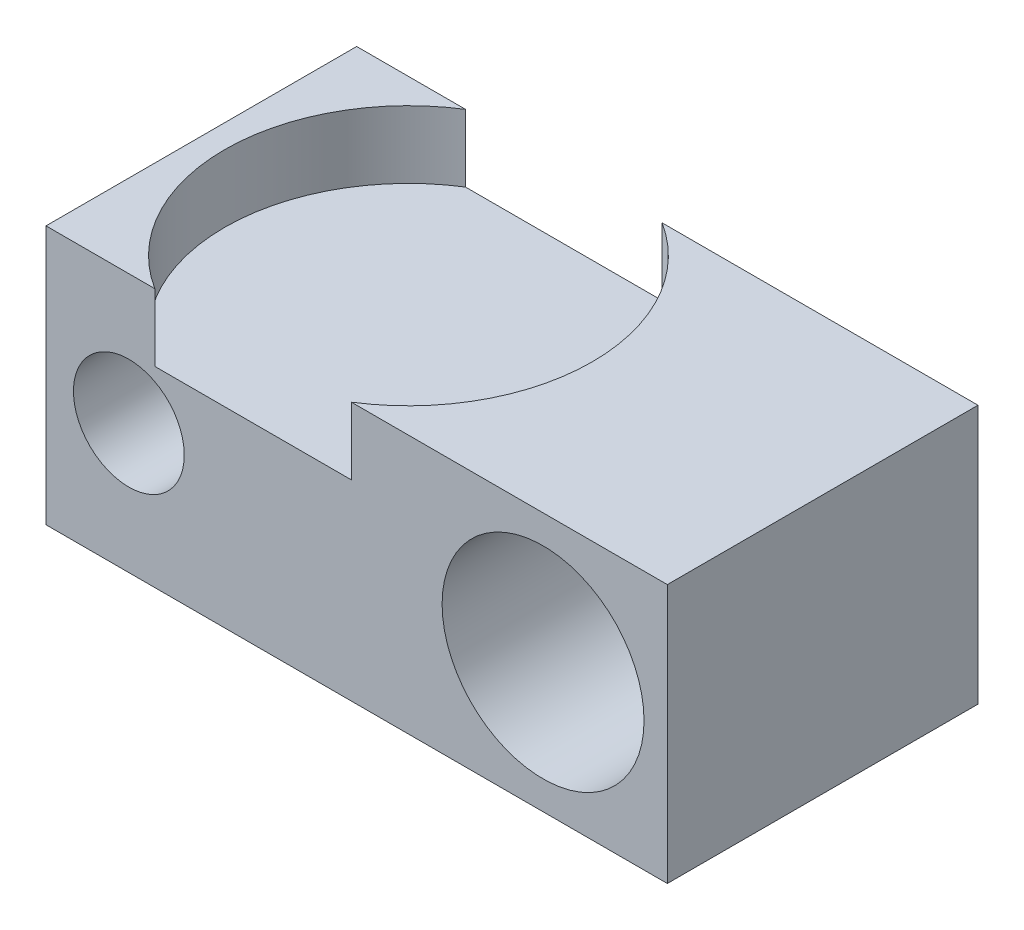
from build123d import *
from build123d.topology import SkipClean

# Parameters (mm, degrees)
SKETCH1_W           = 60
SKETCH1_H           = 25
SKETCH1_R           = 9.75
SKETCH1_R_2         = 5.35
BOSS_EXTRUDE1_DEPTH = 30
BOSS_EXTRUDE2_DEPTH = 0.0001
CUT_EXTRUDE1_START  = -6.5
SKETCH2_3_R         = 17.75
CUT_EXTRUDE1_DEPTH  = 6.5


with BuildPart() as part:
    # Sketch1 → Boss-Extrude1 (new body)
    with BuildSketch(Plane.XY):
        Rectangle(SKETCH1_W, SKETCH1_H)
        with Locations((18, 0)):
            Circle(SKETCH1_R, mode=Mode.SUBTRACT)
        with Locations((-22, 0)):
            Circle(SKETCH1_R_2, mode=Mode.SUBTRACT)
    extrude(amount=BOSS_EXTRUDE1_DEPTH)

    # Sketch2 → Boss-Extrude2 (add)
    with BuildSketch(Plane(origin=(0, 12.5, 0), x_dir=(1, 0, 0), z_dir=(0, 1, 0))):
        with BuildLine():
            ThreePointArc((-0.509873552, 0), (7.75, -15), (-0.509873552, -30))
            Line((-0.509873552, -30), (30, -30))
            Line((30, -30), (30, 0))
            Line((30, 0), (-0.509873552, 0))
        make_face()
        with BuildLine():
            ThreePointArc((-19.490126448, -30), (-27.75, -15), (-19.490126448, 0))
            Line((-19.490126448, 0), (-30, 0))
            Line((-30, 0), (-30, -30))
            Line((-30, -30), (-19.490126448, -30))
        make_face()
    extrude(amount=BOSS_EXTRUDE2_DEPTH)

    # Sketch2<3> → Cut-Extrude1 (cut)
    with SkipClean():  # the faces are left unmerged after this step: merging them gives an invalid solid
        with BuildSketch(Plane(origin=(0, 12.5, 0), x_dir=(1, 0, 0), z_dir=(0, 1, 0)).offset(CUT_EXTRUDE1_START)):
            with Locations((-10, -15)):
                Circle(SKETCH2_3_R)
        extrude(amount=CUT_EXTRUDE1_DEPTH, mode=Mode.SUBTRACT)


solid = part.part
